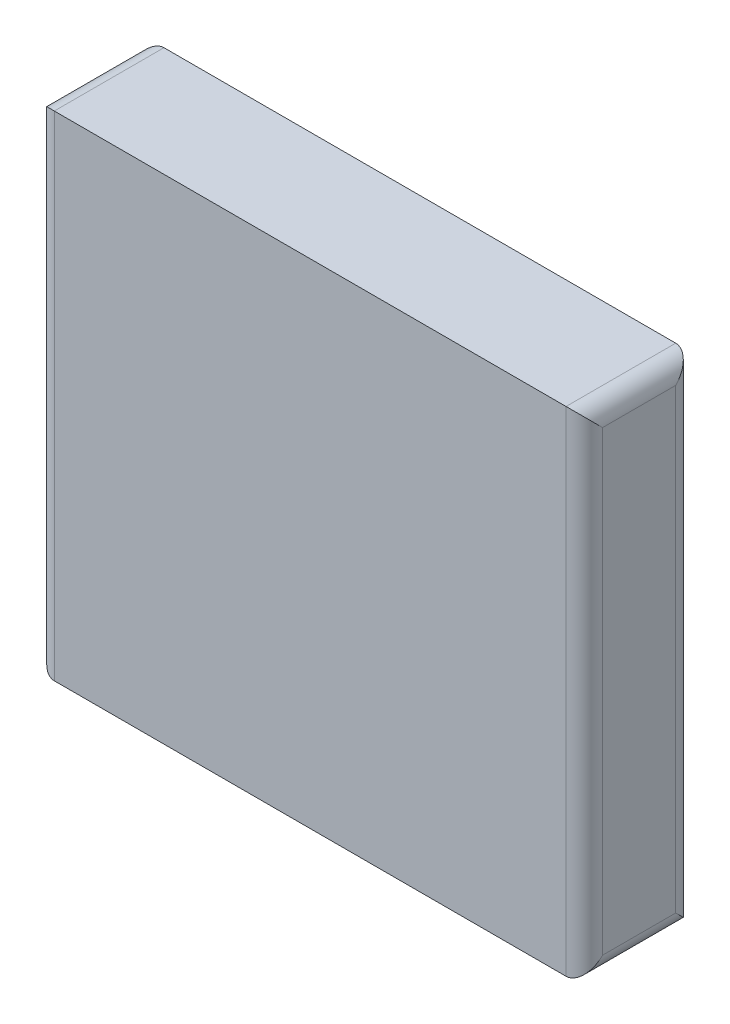
from build123d import *

# Parameters (mm, degrees)
ESQUISSE1_W        = 30
ESQUISSE1_H        = 27
BOSS_EXTRU_1_DEPTH = 6
CONG_1_R           = 1


with BuildPart() as part:
    # Esquisse1 → Boss.-Extru.1 (new body)
    with BuildSketch(Plane.XY):
        with Locations((15, 13.5)):
            Rectangle(ESQUISSE1_W, ESQUISSE1_H)
    extrude(amount=BOSS_EXTRU_1_DEPTH)

    # Congé1
    cong_1_edges = [part.edges().sort_by_distance(p)[0] for p in [
        (30, 13.5, 6),
        (0, 13.5, 6),
        (30, 13.5, 0),
        (0, 13.5, 0),
        (0, 27, 3),
        (30, 27, 3),
        (30, 0, 3),
        (0, 0, 3),
    ]]
    fillet(cong_1_edges, radius=CONG_1_R)


solid = part.part
